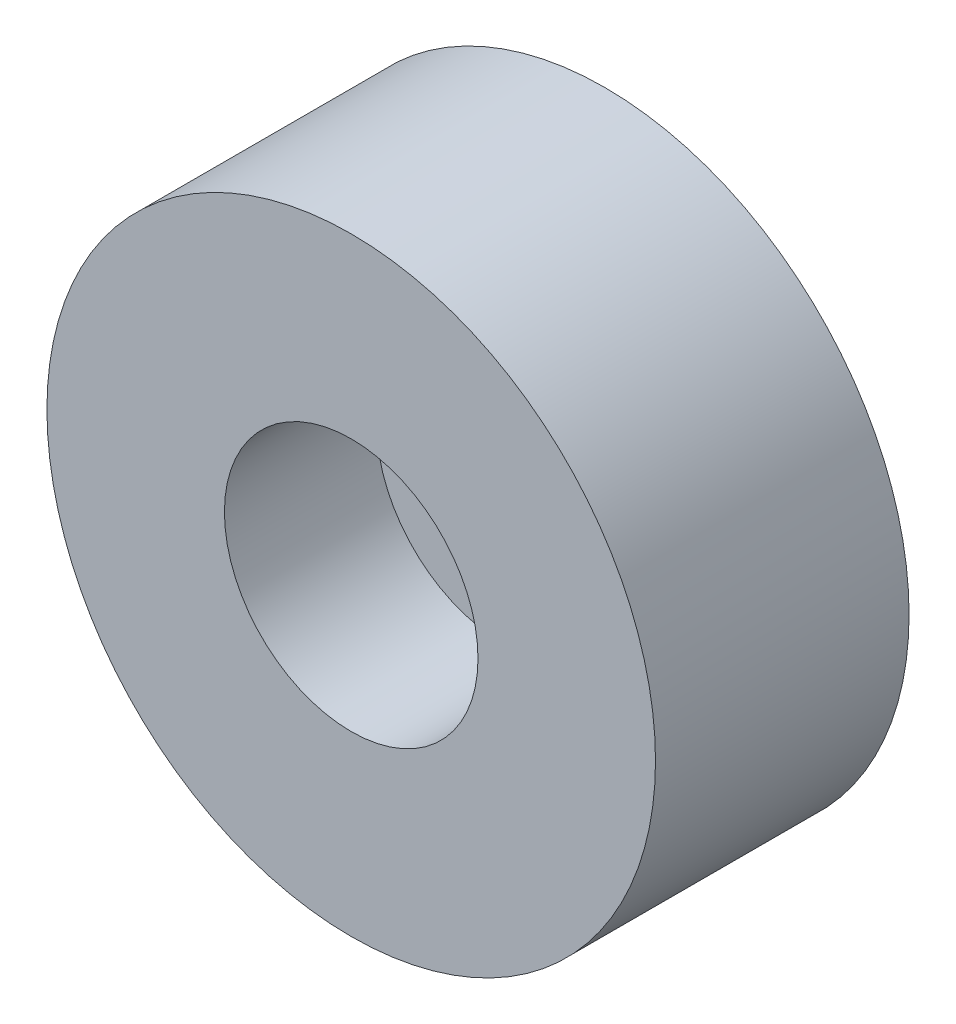
from build123d import *

# Parameters (mm, degrees)
SKETCH_1_R          = 6
EXTRUDE_1_DEPTH     = 5
SKETCH_2_R          = 2.5
CUT_EXTRUDE_1_DEPTH = 3
SKETCH_3_R          = 1
CUT_EXTRUDE_2_DEPTH = 3


with BuildPart() as part:
    # 草图1 → 凸台-拉伸1 (new body)
    with BuildSketch(Plane.XY):
        Circle(SKETCH_1_R)
    extrude(amount=EXTRUDE_1_DEPTH)

    # 草图2 → 切除-拉伸1 (cut)
    with BuildSketch(Plane.XY.offset(5)):
        Circle(SKETCH_2_R)
    extrude(amount=-CUT_EXTRUDE_1_DEPTH, mode=Mode.SUBTRACT)

    # 草图3 → 切除-拉伸2 (cut)
    with BuildSketch(Plane.XY.offset(2)):
        Circle(SKETCH_3_R)
    extrude(amount=-CUT_EXTRUDE_2_DEPTH, mode=Mode.SUBTRACT)


solid = part.part
